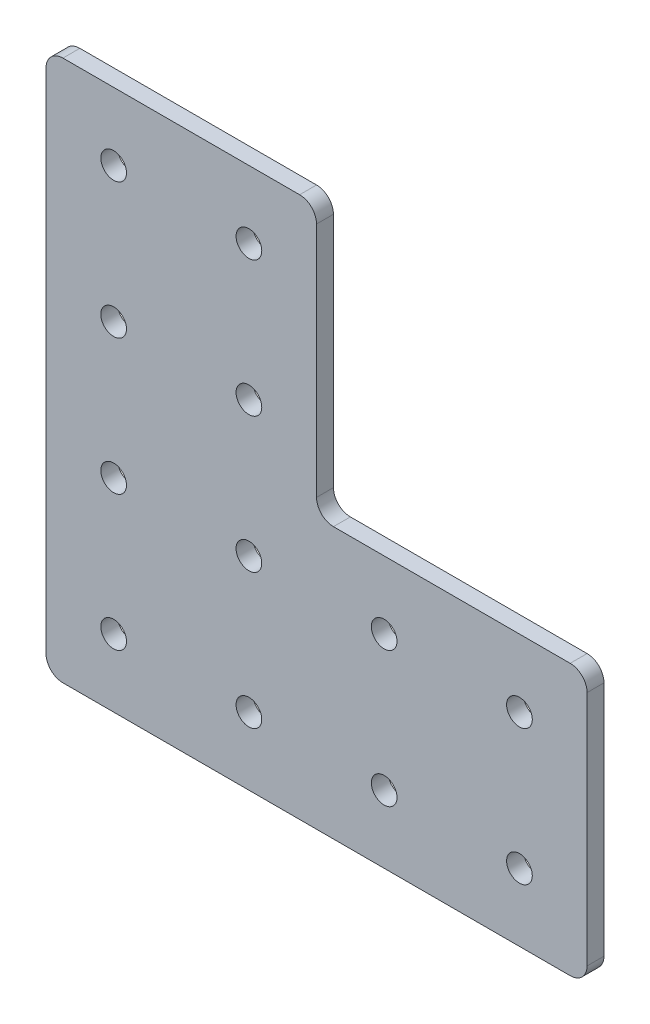
from build123d import *

# Parameters (mm, degrees)
SKETCH1_R           = 2.413
BOSS_EXTRUDE1_DEPTH = 3.175
FILLET1_R           = 3.175


with BuildPart() as part:
    # Sketch1 → Boss-Extrude1 (new body)
    with BuildSketch(Plane.XY):
        Polygon((0, 0), (101.6, 0), (101.6, 50.8), (50.8, 50.8), (50.8, 101.6), (0, 101.6), align=None)
        with Locations((12.7, 88.9)):
            Circle(SKETCH1_R, mode=Mode.SUBTRACT)
        with Locations((38.1, 88.9)):
            Circle(SKETCH1_R, mode=Mode.SUBTRACT)
        with Locations((38.1, 63.5)):
            Circle(SKETCH1_R, mode=Mode.SUBTRACT)
        with Locations((12.7, 63.5)):
            Circle(SKETCH1_R, mode=Mode.SUBTRACT)
        with Locations(Location((38.1, 12.7, 0), (0, 0, 180))):
            Circle(SKETCH1_R, mode=Mode.SUBTRACT)
        with Locations(Location((38.1, 38.1, 0), (0, 0, 180))):
            Circle(SKETCH1_R, mode=Mode.SUBTRACT)
        with Locations(Location((12.7, 38.1, 0), (0, 0, 180))):
            Circle(SKETCH1_R, mode=Mode.SUBTRACT)
        with Locations(Location((12.7, 12.7, 0), (0, 0, 180))):
            Circle(SKETCH1_R, mode=Mode.SUBTRACT)
        with Locations((88.9, 12.7)):
            Circle(SKETCH1_R, mode=Mode.SUBTRACT)
        with Locations((63.5, 12.7)):
            Circle(SKETCH1_R, mode=Mode.SUBTRACT)
        with Locations((63.5, 38.1)):
            Circle(SKETCH1_R, mode=Mode.SUBTRACT)
        with Locations((88.9, 38.1)):
            Circle(SKETCH1_R, mode=Mode.SUBTRACT)
    extrude(amount=BOSS_EXTRUDE1_DEPTH)

    # Fillet1
    fillet1_edges = [part.edges().sort_by_distance(p)[0] for p in [
        (0, 101.6, 1.5875),
        (50.8, 101.6, 1.5875),
        (50.8, 50.8, 1.5875),
        (101.6, 50.8, 1.5875),
        (101.6, 0, 1.5875),
        (0, 0, 1.5875),
    ]]
    fillet(fillet1_edges, radius=FILLET1_R)


solid = part.part
